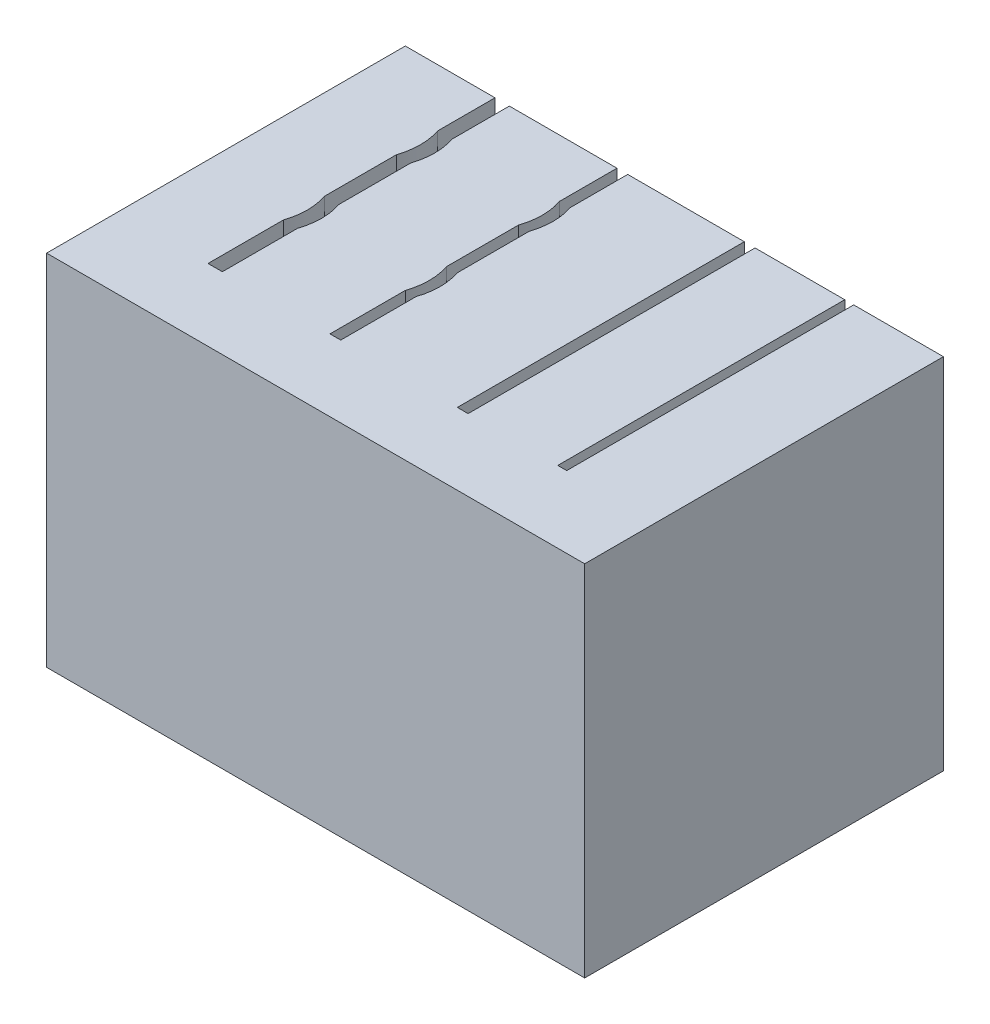
from build123d import *

# Parameters (mm, degrees)
SKETCH1_W           = 15
SKETCH1_H           = 10
BOSS_EXTRUDE1_DEPTH = 10
SKETCH2_W           = 0.4
SKETCH2_H           = 8
SKETCH2_W_2         = 0.3
SKETCH2_W_3         = 0.25
CUT_EXTRUDE1_DEPTH  = 5
BOSS_EXTRUDE2_DEPTH = 5
CUT_EXTRUDE2_DEPTH  = 5


with BuildPart() as part:
    # Sketch1 → Boss-Extrude1 (new body)
    with BuildSketch(Plane(origin=(0, 0, 0), x_dir=(1, 0, 0), z_dir=(0, 1, 0))):
        Rectangle(SKETCH1_W, SKETCH1_H)
    extrude(amount=BOSS_EXTRUDE1_DEPTH)

    # Sketch2 → Cut-Extrude1 (cut)
    with BuildSketch(Plane(origin=(0, 10, 0), x_dir=(1, 0, 0), z_dir=(0, 1, 0))):
        with Locations((-4.8, 1)):
            Rectangle(SKETCH2_W, SKETCH2_H)
        with Locations((-1.45, 1)):
            Rectangle(SKETCH2_W_2, SKETCH2_H)
        with Locations((2.1, 1)):
            Rectangle(SKETCH2_W_2, SKETCH2_H)
        with Locations((4.875, 1)):
            Rectangle(SKETCH2_W_3, SKETCH2_H)
    extrude(amount=-CUT_EXTRUDE1_DEPTH, mode=Mode.SUBTRACT)

    # Sketch3 → Boss-Extrude2 (add)
    with BuildSketch(Plane(origin=(0, 10, 0), x_dir=(1, 0, 0), z_dir=(0, 1, 0))):
        with BuildLine():
            Line((-5, 3.4), (-5, 2.25))
            ThreePointArc((-5, 2.25), (-4.90568901, 2.825), (-5, 3.4))
        make_face()
        with BuildLine():
            Line((-5, 0.25), (-5, -0.9))
            ThreePointArc((-5, -0.9), (-4.90568901, -0.325), (-5, 0.25))
        make_face()
        with BuildLine():
            Line((-1.6, 3.4), (-1.6, 2.25))
            ThreePointArc((-1.6, 2.25), (-1.50568901, 2.825), (-1.6, 3.4))
        make_face()
        with BuildLine():
            Line((-1.6, 0.25), (-1.6, -0.9))
            ThreePointArc((-1.6, -0.9), (-1.50568901, -0.325), (-1.6, 0.25))
        make_face()
    extrude(amount=-BOSS_EXTRUDE2_DEPTH)

    # Sketch4 → Cut-Extrude2 (cut)
    with BuildSketch(Plane(origin=(0, 10, 0), x_dir=(1, 0, 0), z_dir=(0, 1, 0))):
        with BuildLine():
            Line((-4.6, 3.4), (-4.6, 2.25))
            ThreePointArc((-4.6, 2.25), (-4.50568901, 2.825), (-4.6, 3.4))
        make_face()
        with BuildLine():
            Line((-4.6, 0.25), (-4.6, -0.9))
            ThreePointArc((-4.6, -0.9), (-4.50568901, -0.325), (-4.6, 0.25))
        make_face()
        with BuildLine():
            Line((-1.3, 3.4), (-1.3, 2.25))
            ThreePointArc((-1.3, 2.25), (-1.20568901, 2.825), (-1.3, 3.4))
        make_face()
        with BuildLine():
            Line((-1.3, 0.25), (-1.3, -0.9))
            ThreePointArc((-1.3, -0.9), (-1.20568901, -0.325), (-1.3, 0.25))
        make_face()
    extrude(amount=-CUT_EXTRUDE2_DEPTH, mode=Mode.SUBTRACT)


solid = part.part
